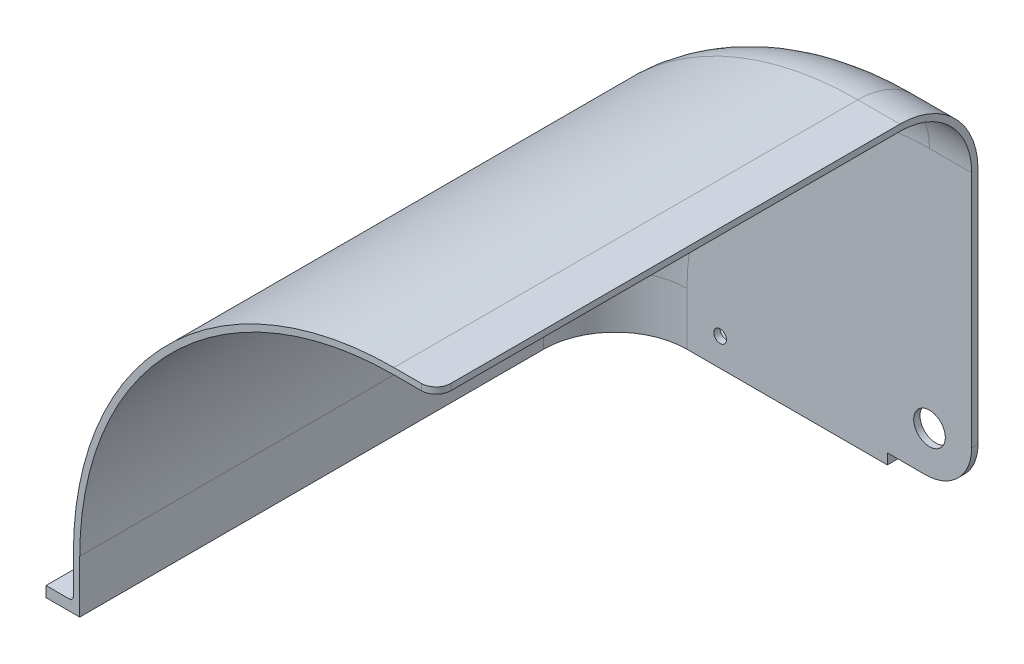
from build123d import *

# Parameters (mm, degrees)
SKETCH1_R           = 1.6
BOSS_EXTRUDE1_DEPTH = 5
BOSS_EXTRUDE5_DEPTH = 20
FILLET8_R           = 34
FILLET9_R           = 37
REVOLVE4_ANGLE      = 90
BOSS_EXTRUDE6_DEPTH = 20
CUT_EXTRUDE3_REACH  = 593.738
SKETCH16_W          = 40
SKETCH16_H          = 5
FILLET10_R          = 22
CUT_EXTRUDE4_REACH  = 581.899
SKETCH17_R          = 7.5
FILLET11_R          = 5
FILLET12_R          = 2
SKETCH18_R          = 3
CUT_EXTRUDE5_DEPTH  = 7
SKETCH19_W          = 241.399404809
SKETCH19_H          = 285.510994658
CUT_EXTRUDE6_DEPTH  = 269
FILLET13_R          = 7


with BuildPart() as part:
    # Sketch1 → Boss-Extrude1 (new body)
    with BuildSketch(Plane(origin=(0, 0, 0), x_dir=(1, 0, 0), z_dir=(0, 1, 0))):
        Polygon((-165, 270), (-165, -270), (0, -270), (0, -254), (-149, -254), (-149, 254), (0, 254), (0, 270), align=None)
        with Locations(Location((-159, 130, 0), (0, 0, 270))):
            Circle(SKETCH1_R, mode=Mode.SUBTRACT)
        with Locations(Location((-159, 50, 0), (0, 0, 270))):
            Circle(SKETCH1_R, mode=Mode.SUBTRACT)
        with Locations(Location((-120, 264, 0), (0, 0, 270))):
            Circle(SKETCH1_R, mode=Mode.SUBTRACT)
        with Locations(Location((-40, 264, 0), (0, 0, 270))):
            Circle(SKETCH1_R, mode=Mode.SUBTRACT)
        with Locations(Location((-159, 210, 0), (0, 0, 270))):
            Circle(SKETCH1_R, mode=Mode.SUBTRACT)
        with Locations(Location((-40, -264, 0), (0, 0, 90))):
            Circle(SKETCH1_R, mode=Mode.SUBTRACT)
        with Locations(Location((-120, -264, 0), (0, 0, 90))):
            Circle(SKETCH1_R, mode=Mode.SUBTRACT)
        with Locations(Location((-159, -210, 0), (0, 0, 90))):
            Circle(SKETCH1_R, mode=Mode.SUBTRACT)
        with Locations(Location((-159, -50, 0), (0, 0, 90))):
            Circle(SKETCH1_R, mode=Mode.SUBTRACT)
        with Locations(Location((-159, -130, 0), (0, 0, 90))):
            Circle(SKETCH1_R, mode=Mode.SUBTRACT)
    extrude(amount=BOSS_EXTRUDE1_DEPTH)

    # Sketch12 → Boss-Extrude5 (add)
    with BuildSketch(Plane(origin=(0, 5, 0), x_dir=(1, 0, 0), z_dir=(0, 1, 0))):
        Polygon((0, 254), (-149, 254), (-149, -254), (0, -254), (0, -257), (-152, -257), (-152, 257), (0, 257), align=None)
    extrude(amount=BOSS_EXTRUDE5_DEPTH)

    # Fillet8
    fillet8_edges = [part.edges().sort_by_distance(p)[0] for p in [
        (-149, 12.5, -254),
        (-149, 12.5, 254),
    ]]
    fillet(fillet8_edges, radius=FILLET8_R)

    # Fillet9
    fillet9_edges = [part.edges().sort_by_distance(p)[0] for p in [
        (-152, 15, -257),
        (-152, 15, 257),
    ]]
    fillet(fillet9_edges, radius=FILLET9_R)

    # Sketch13 → Revolve4 (revolve)
    with BuildSketch(Plane(origin=(0, 25, 0), x_dir=(1, 0, 0), z_dir=(0, 1, 0))):
        with BuildLine():
            Line((0, 254), (-115, 254))
            ThreePointArc((-115, 254), (-139.04163056, 244.04163056), (-149, 220))
            Line((-149, 220), (-149, -220))
            ThreePointArc((-149, -220), (-139.04163056, -244.04163056), (-115, -254))
            Line((-115, -254), (0, -254))
            Line((0, -254), (0, -257))
            Line((0, -257), (-115, -257))
            ThreePointArc((-115, -257), (-141.162950904, -246.162950904), (-152, -220))
            Line((-152, -220), (-152, 220))
            ThreePointArc((-152, 220), (-141.162950904, 246.162950904), (-115, 257))
            Line((-115, 257), (0, 257))
            Line((0, 257), (0, 254))
        make_face()
    revolve(axis=Axis((0, 25, -257), (0, 0, -1)), revolution_arc=REVOLVE4_ANGLE)

    # Sketch15 → Boss-Extrude6 (add)
    with BuildSketch(Plane(origin=(0, 0, 0), x_dir=(0, 0, -1), z_dir=(1, 0, 0))):
        with BuildLine():
            Line((-254, 5), (-254, 140))
            ThreePointArc((-254, 140), (-244.04163056, 164.04163056), (-220, 174))
            Line((-220, 174), (220, 174))
            ThreePointArc((220, 174), (244.04163056, 164.04163056), (254, 140))
            Line((254, 140), (254, 5))
            Line((254, 5), (254, 0))
            Line((254, 0), (270, 0))
            Line((270, 0), (270, 5))
            Line((270, 5), (257, 5))
            Line((257, 5), (257, 140))
            ThreePointArc((257, 140), (246.162950904, 166.162950904), (220, 177))
            Line((220, 177), (-220, 177))
            ThreePointArc((-220, 177), (-246.162950904, 166.162950904), (-257, 140))
            Line((-257, 140), (-257, 5))
            Line((-257, 5), (-270, 5))
            Line((-270, 5), (-270, 0))
            Line((-270, 0), (-254, 0))
            Line((-254, 0), (-254, 5))
        make_face()
    extrude(amount=BOSS_EXTRUDE6_DEPTH)

    # Cut-Extrude3: up to this face of the body (flat: up to its plane)
    cut_extrude3_end = Plane(part.part.faces().sort_by_distance((-72.5, 2.5, -270))[0])
    # Sketch16 → Cut-Extrude3 (cut, up to the picked face)
    with BuildSketch(Plane.XY.offset(270), mode=Mode.PRIVATE) as cut_extrude3_sk1:
        with Locations((0, 2.5)):
            Rectangle(SKETCH16_W, SKETCH16_H)
    cut_extrude3_tool1 = split(extrude(cut_extrude3_sk1.sketch, amount=-CUT_EXTRUDE3_REACH, mode=Mode.PRIVATE), bisect_by=cut_extrude3_end, keep=Keep.BOTH, mode=Mode.PRIVATE)
    add(cut_extrude3_tool1.solids().sort_by(Axis((0, 2.5, 270), (0, 0, -1)))[0], mode=Mode.SUBTRACT)

    # Fillet10
    fillet10_edges = [part.edges().sort_by_distance(p)[0] for p in [
        (20, 5, 255.5),
        (20, 5, -255.5),
    ]]
    fillet(fillet10_edges, radius=FILLET10_R)

    # Cut-Extrude4: up to this face of the body (flat: up to its plane)
    cut_extrude4_end = Plane(part.part.faces().sort_by_distance((-40.16059182, 65.16059182, -257))[0])
    # Sketch17 → Cut-Extrude4 (cut, up to the picked face)
    with BuildSketch(Plane.XY.offset(257), mode=Mode.PRIVATE) as cut_extrude4_sk1:
        with Locations((0, 25)):
            Circle(SKETCH17_R)
    cut_extrude4_tool1 = split(extrude(cut_extrude4_sk1.sketch, amount=-CUT_EXTRUDE4_REACH, mode=Mode.PRIVATE), bisect_by=cut_extrude4_end, keep=Keep.BOTH, mode=Mode.PRIVATE)
    add(cut_extrude4_tool1.solids().sort_by(Axis((0, 25, 257), (0, 0, -1)))[0], mode=Mode.SUBTRACT)

    # Fillet11
    fillet11_edges = [part.edges().sort_by_distance(p)[0] for p in [
        (-165, 2.5, 270),
        (-165, 2.5, -270),
    ]]
    fillet(fillet11_edges, radius=FILLET11_R)

    # Fillet12
    fillet12_edges = [part.edges().sort_by_distance(p)[0] for p in [
        (-152, 5, 0),
        (-67.5, 5, 257),
        (-141.162950904, 5, -246.162950904),
        (-141.162950904, 5, 246.162950904),
        (-67.5, 5, -257),
    ]]
    fillet(fillet12_edges, radius=FILLET12_R)

    # Sketch18 → Cut-Extrude5 (cut)
    with BuildSketch(Plane(origin=(0, 0, -257), x_dir=(-1, 0, 0), z_dir=(0, 0, -1))):
        with Locations((99.306112319, 13.240065646)):
            Circle(SKETCH18_R)
    extrude(amount=-CUT_EXTRUDE5_DEPTH, mode=Mode.SUBTRACT)

    # Sketch19 → Cut-Extrude6 (cut)
    with BuildSketch(Plane.XZ):
        with Locations((-100.699702405, 142.755497329)):
            Rectangle(SKETCH19_W, SKETCH19_H)
    extrude(amount=-CUT_EXTRUDE6_DEPTH, mode=Mode.SUBTRACT)

    # Fillet13
    fillet13_edges = [part.edges().sort_by_distance(p)[0] for p in [
        (20, 175.5, 0),
    ]]
    fillet(fillet13_edges, radius=FILLET13_R)


solid = part.part
